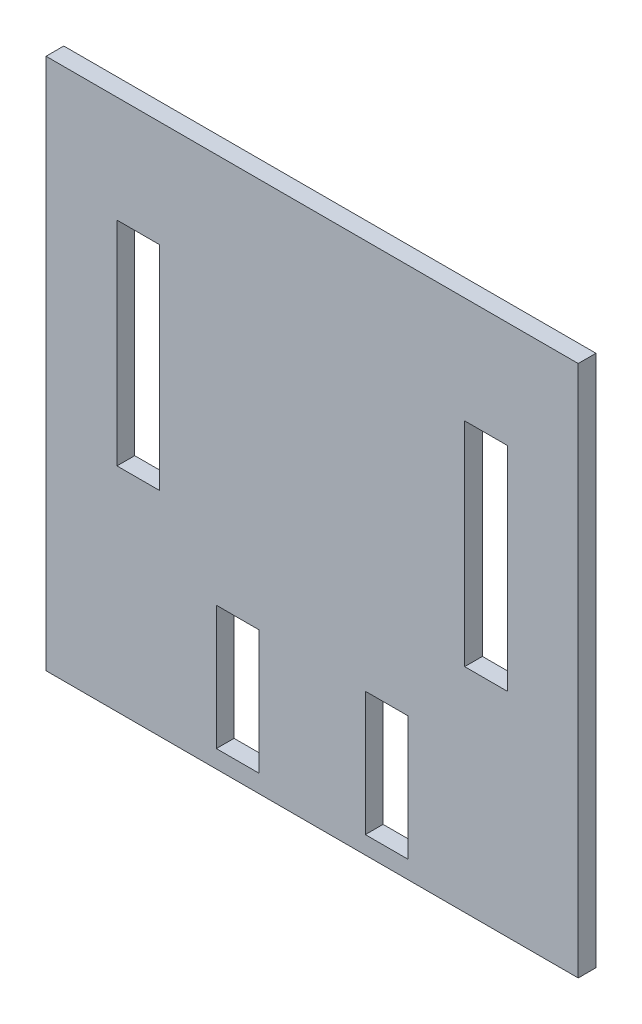
from build123d import *

# Parameters (mm, degrees)
ESQUISSE1_W             = 150
ESQUISSE1_H             = 150
BOSS_EXTRU_1_DEPTH      = 5
ESQUISSE2_W             = 12
ESQUISSE2_H             = 60
ESQUISSE2_H_2           = 35
ENL_V_MAT_EXTRU_1_DEPTH = 5


with BuildPart() as part:
    # Esquisse1 → Boss.-Extru.1 (new body)
    with BuildSketch(Plane.XY):
        with Locations((75, 75)):
            Rectangle(ESQUISSE1_W, ESQUISSE1_H)
    extrude(amount=BOSS_EXTRU_1_DEPTH)

    # Esquisse2 → Enlèv. mat.-Extru.1 (cut)
    with BuildSketch(Plane.XY.offset(5)):
        with Locations((26, 90)):
            Rectangle(ESQUISSE2_W, ESQUISSE2_H)
        with Locations((124, 90)):
            Rectangle(ESQUISSE2_W, ESQUISSE2_H)
        with Locations((54, 22.5)):
            Rectangle(ESQUISSE2_W, ESQUISSE2_H_2)
        with Locations((96, 22.5)):
            Rectangle(ESQUISSE2_W, ESQUISSE2_H_2)
    extrude(amount=-ENL_V_MAT_EXTRU_1_DEPTH, mode=Mode.SUBTRACT)


solid = part.part
